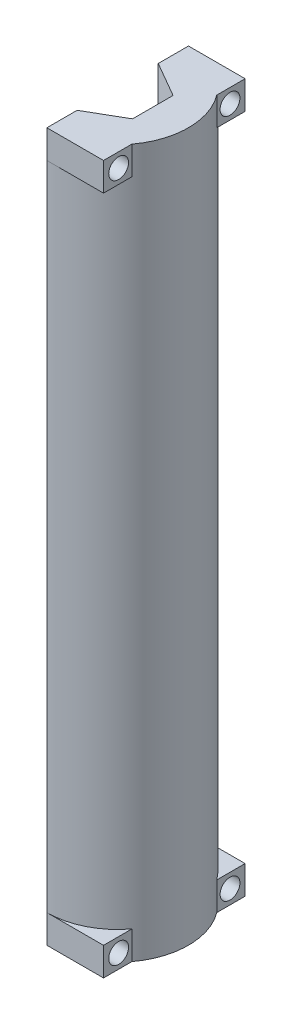
from build123d import *

# Parameters (mm, degrees)
MAIN_BODY_DEPTH                = 75
SKETCH2_W                      = 3.204513997
SKETCH2_H                      = 3
BACK_SCREW_HOLES_SUPPORT_DEPTH = 6
SKETCH3_R                      = 1.05
BACK_SCREW_HOLES_DEPTH         = 76.746287038


with BuildPart() as part:
    # Sketch1 → Main Body (new body)
    with BuildSketch(Plane(origin=(0, 0, 0), x_dir=(1, 0, 0), z_dir=(0, 1, 0))):
        with BuildLine():
            Line((0, 7.5), (0, 4.295486003))
            Line((0, 4.295486003), (3.72, 2.147743001))
            Line((3.72, 2.147743001), (3.72, -2.147743001))
            Line((3.72, -2.147743001), (0, -4.295486003))
            Line((0, -4.295486003), (0, -7.5))
            ThreePointArc((0, -7.5), (7.5, 0), (0, 7.5))
        make_face()
    extrude(amount=MAIN_BODY_DEPTH)

    # Sketch2 → Back Screw Holes Support (add)
    with BuildSketch(Plane.ZY):
        with Locations((-5.897743002, 1.5)):
            Rectangle(SKETCH2_W, SKETCH2_H)
        with Locations((-5.897743002, 73.5)):
            Rectangle(SKETCH2_W, SKETCH2_H)
    back_screw_holes_support = extrude(amount=-BACK_SCREW_HOLES_SUPPORT_DEPTH)

    # Sketch3 → Back Screw Holes (cut, through all)
    with BuildSketch(Plane.ZY):
        with Locations((-5.897743001, 73.5)):
            Circle(SKETCH3_R)
        with Locations((-5.897743001, 1.5)):
            Circle(SKETCH3_R)
    back_screw_holes = extrude(amount=-BACK_SCREW_HOLES_DEPTH, mode=Mode.SUBTRACT)

    # Front Screw Holes and Support: Back Screw Holes Support, Back Screw Holes across plane
    add(back_screw_holes_support.mirror(Plane.XY))
    add(back_screw_holes.mirror(Plane.XY), mode=Mode.SUBTRACT)


solid = part.part
